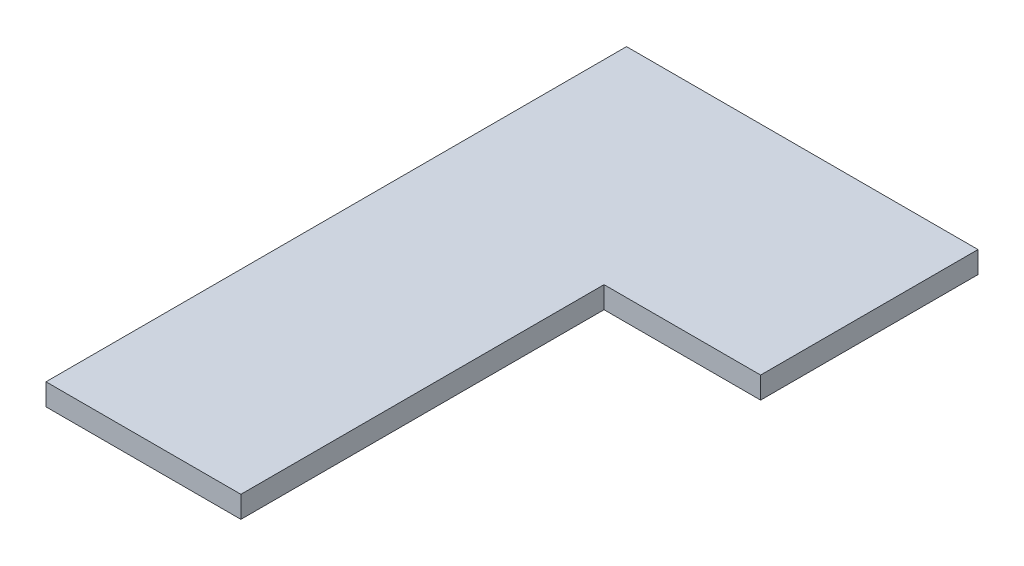
from build123d import *

# Parameters (mm, degrees)
EXTRUDE_1_DEPTH = 3


with BuildPart() as part:
    # 草图1 → 凸台-拉伸1 (new body)
    with BuildSketch(Plane(origin=(0, 0, 0), x_dir=(1, 0, 0), z_dir=(0, 1, 0))):
        Polygon((0, 0), (-48.505747126, 0), (-48.505747126, -80.114942529), (-21.609195402, -80.114942529), (-21.609195402, -30), (0, -30), align=None)
    extrude(amount=EXTRUDE_1_DEPTH)


solid = part.part
